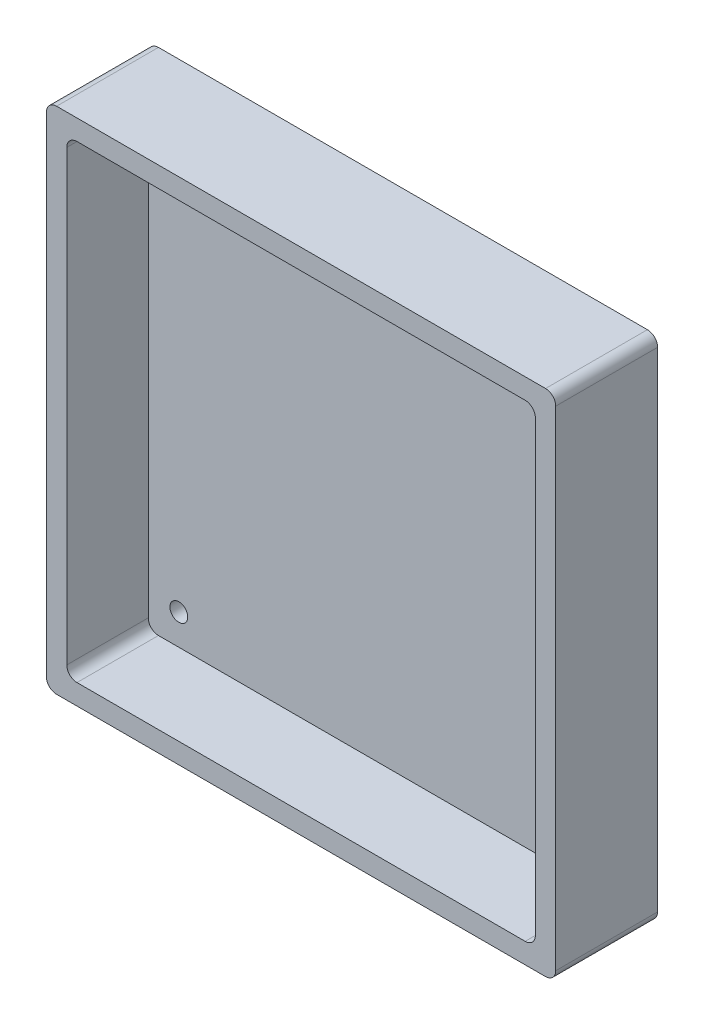
from build123d import *

# Parameters (mm, degrees)
SKETCH1_W           = 100
SKETCH1_H           = 100
BOSS_EXTRUDE1_DEPTH = 20
SKETCH2_W           = 92
SKETCH2_H           = 92
CUT_EXTRUDE1_DEPTH  = 16
FILLET1_R           = 2
SKETCH3_R           = 1.75
CUT_EXTRUDE2_DEPTH  = 16


with BuildPart() as part:
    # Sketch1 → Boss-Extrude1 (new body)
    with BuildSketch(Plane.XY):
        Rectangle(SKETCH1_W, SKETCH1_H)
    extrude(amount=BOSS_EXTRUDE1_DEPTH)

    # Sketch2 → Cut-Extrude1 (cut)
    with BuildSketch(Plane.XY.offset(20)):
        Rectangle(SKETCH2_W, SKETCH2_H)
    extrude(amount=-CUT_EXTRUDE1_DEPTH, mode=Mode.SUBTRACT)

    # Fillet1
    fillet1_edges = [part.edges().sort_by_distance(p)[0] for p in [
        (-46, -46, 12),
        (-46, 46, 12),
        (46, 46, 12),
        (46, -46, 12),
        (-50, 50, 10),
        (50, 50, 10),
        (50, -50, 10),
        (-50, -50, 10),
    ]]
    fillet(fillet1_edges, radius=FILLET1_R)

    # Sketch3 → Cut-Extrude2 (cut)
    with BuildSketch(Plane.XY):
        with Locations((-40, 40)):
            Circle(SKETCH3_R)
        with Locations((40, 40)):
            Circle(SKETCH3_R)
        with Locations((40, -40)):
            Circle(SKETCH3_R)
        with Locations((-40, -40)):
            Circle(SKETCH3_R)
    extrude(amount=CUT_EXTRUDE2_DEPTH, mode=Mode.SUBTRACT)


solid = part.part
